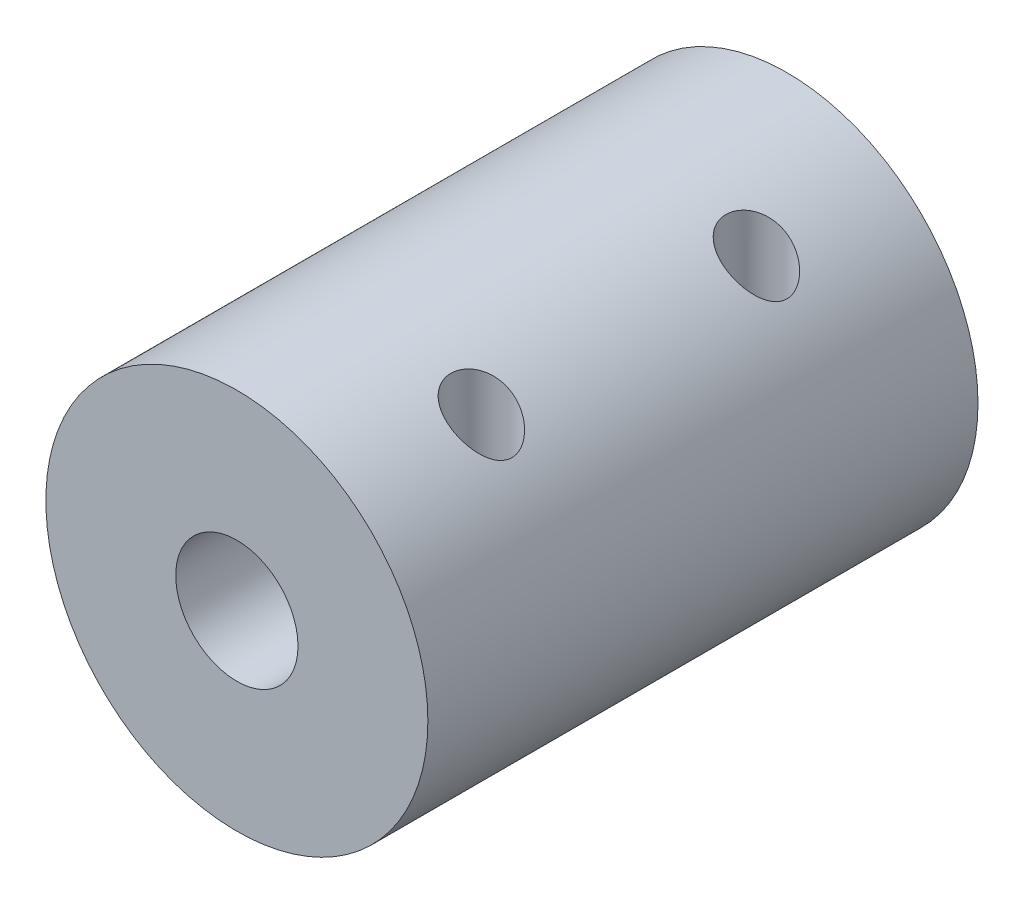
from build123d import *

# Parameters (mm, degrees)
SKETCH_1_R               = 12.5
EXTRUDE_1_DEPTH          = 36
SKETCH_3_R               = 4
CUT_EXTRUDE_1_DEPTH      = 41.10610926
CUT_EXTRUDE_2_DEPTH      = 41.10610926
CUT_EXTRUDE_2_DEPTH_BACK = 41.10610926
SKETCH_4_R               = 2


with BuildPart() as part:
    # 草图1 → 拉伸1 (new body)
    with BuildSketch(Plane.XY):
        Circle(SKETCH_1_R)
    extrude(amount=EXTRUDE_1_DEPTH)

    # 草图3 → 切除-拉伸1 (cut, through all)
    with BuildSketch(Plane.XY.offset(36)):
        Circle(SKETCH_3_R)
    extrude(amount=-CUT_EXTRUDE_1_DEPTH, mode=Mode.SUBTRACT)

    # 草图4 → 切除-拉伸2 (cut, two sides: drawn at the far end of the back side and taken through both)
    with BuildSketch(Plane(origin=(0, 0, 0), x_dir=(1, 0, 0), z_dir=(0, 1, 0)).offset(-CUT_EXTRUDE_2_DEPTH_BACK)):
        with Locations(Location((7, -9, 0), (0, 0, 270))):
            Circle(SKETCH_4_R)
        with Locations(Location((7, -27, 0), (0, 0, 270))):
            Circle(SKETCH_4_R)
    extrude(amount=CUT_EXTRUDE_2_DEPTH + CUT_EXTRUDE_2_DEPTH_BACK, mode=Mode.SUBTRACT)


solid = part.part
